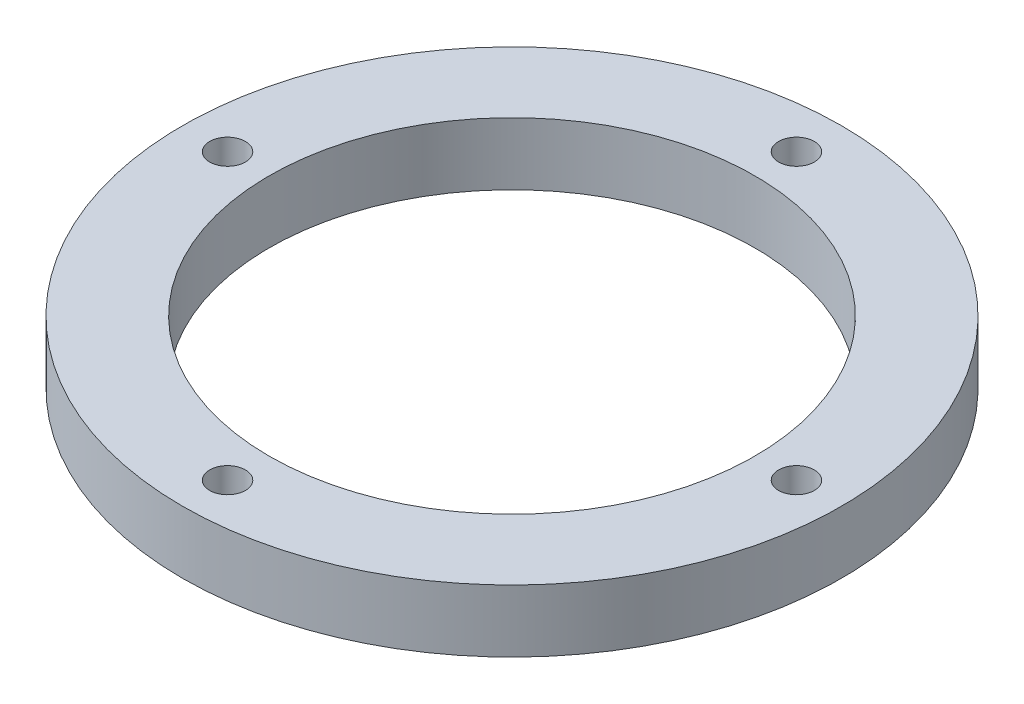
from build123d import *

# Parameters (mm, degrees)
SKETCH_1_R          = 47.5
SKETCH_1_R_2        = 35
EXTRUDE_1_DEPTH     = 9
CUT_EXTRUDE_1_REACH = 69.775
SKETCH_2_R          = 2.575


with BuildPart() as part:
    # 草图1 → 凸台-拉伸1 (new body)
    with BuildSketch(Plane(origin=(0, 0, 0), x_dir=(1, 0, 0), z_dir=(0, 1, 0))):
        with Locations(Location((0, 0, 0), (0, 0, 270))):
            Circle(SKETCH_1_R)
        with Locations(Location((0, 0, 0), (0, 0, 270))):
            Circle(SKETCH_1_R_2, mode=Mode.SUBTRACT)
    extrude(amount=EXTRUDE_1_DEPTH)

    # 草图2 → 切除-拉伸1 (cut, up to next)
    with BuildSketch(Plane(origin=(0, 9, 0), x_dir=(1, 0, 0), z_dir=(0, 1, 0)), mode=Mode.PRIVATE) as cut_extrude_1_sk1:
        with Locations(Location((0, 41, 0), (0, 0, 270))):
            Circle(SKETCH_2_R)
    cut_extrude_1_tool1 = extrude(cut_extrude_1_sk1.sketch, amount=-CUT_EXTRUDE_1_REACH, mode=Mode.PRIVATE) & part.part
    # 草图2 → 切除-拉伸1 (cut, up to next)
    with BuildSketch(Plane(origin=(0, 9, 0), x_dir=(1, 0, 0), z_dir=(0, 1, 0)), mode=Mode.PRIVATE) as cut_extrude_1_sk2:
        with Locations(Location((41, 0, 0), (0, 0, 270))):
            Circle(SKETCH_2_R)
    cut_extrude_1_tool2 = extrude(cut_extrude_1_sk2.sketch, amount=-CUT_EXTRUDE_1_REACH, mode=Mode.PRIVATE) & part.part
    # 草图2 → 切除-拉伸1 (cut, up to next)
    with BuildSketch(Plane(origin=(0, 9, 0), x_dir=(1, 0, 0), z_dir=(0, 1, 0)), mode=Mode.PRIVATE) as cut_extrude_1_sk3:
        with Locations(Location((0, -41, 0), (0, 0, 270))):
            Circle(SKETCH_2_R)
    cut_extrude_1_tool3 = extrude(cut_extrude_1_sk3.sketch, amount=-CUT_EXTRUDE_1_REACH, mode=Mode.PRIVATE) & part.part
    # 草图2 → 切除-拉伸1 (cut, up to next)
    with BuildSketch(Plane(origin=(0, 9, 0), x_dir=(1, 0, 0), z_dir=(0, 1, 0)), mode=Mode.PRIVATE) as cut_extrude_1_sk4:
        with Locations(Location((-41, 0, 0), (0, 0, 270))):
            Circle(SKETCH_2_R)
    cut_extrude_1_tool4 = extrude(cut_extrude_1_sk4.sketch, amount=-CUT_EXTRUDE_1_REACH, mode=Mode.PRIVATE) & part.part
    add(cut_extrude_1_tool1.solids().sort_by_distance((0, 9, -41))[0], mode=Mode.SUBTRACT)
    add(cut_extrude_1_tool2.solids().sort_by_distance((41, 9, 0))[0], mode=Mode.SUBTRACT)
    add(cut_extrude_1_tool3.solids().sort_by_distance((0, 9, 41))[0], mode=Mode.SUBTRACT)
    add(cut_extrude_1_tool4.solids().sort_by_distance((-41, 9, 0))[0], mode=Mode.SUBTRACT)


solid = part.part
